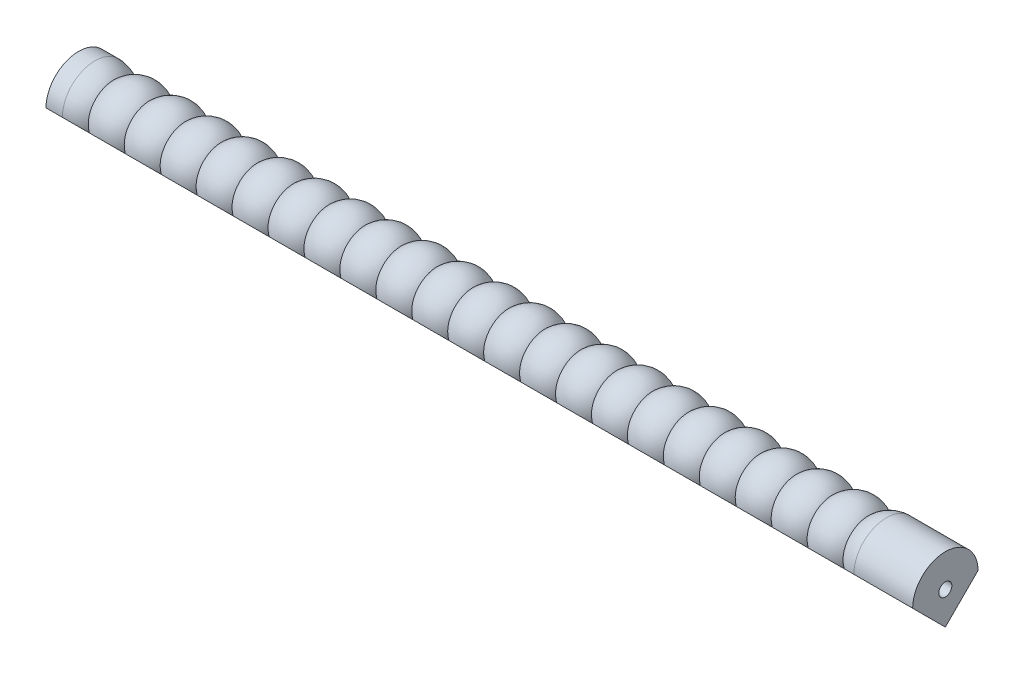
from build123d import *

# Parameters (mm, degrees)
CUT_EXTRUDE1_START = -150
CUT_EXTRUDE1_DEPTH = 150


with BuildPart() as part:
    # Sketch1 → Revolve2 (revolve)
    with BuildSketch(Plane(origin=(0, 0, 0), x_dir=(1, 0, 0), z_dir=(0, 1, 0)), mode=Mode.PRIVATE) as revolve2_sk:
        with BuildLine():
            Line((0, 0), (0, 5))
            Line((0, 5), (2.5, 5))
            ThreePointArc((2.5, 5), (4.038280284, 4.716911107), (5.375, 3.90473751))
            ThreePointArc((5.375, 3.90473751), (8.125, 5), (10.875, 3.90473751))
            ThreePointArc((10.875, 3.90473751), (13.625, 5), (16.375, 3.90473751))
            ThreePointArc((16.375, 3.90473751), (19.125, 5), (21.875, 3.90473751))
            ThreePointArc((21.875, 3.90473751), (24.625, 5), (27.375, 3.90473751))
            ThreePointArc((27.375, 3.90473751), (30.125, 5), (32.875, 3.90473751))
            ThreePointArc((32.875, 3.90473751), (35.625, 5), (38.375, 3.90473751))
            ThreePointArc((38.375, 3.90473751), (41.125, 5), (43.875, 3.90473751))
            ThreePointArc((43.875, 3.90473751), (46.625, 5), (49.375, 3.90473751))
            ThreePointArc((49.375, 3.90473751), (52.125, 5), (54.875, 3.90473751))
            ThreePointArc((54.875, 3.90473751), (57.625, 5), (60.375, 3.90473751))
            ThreePointArc((60.375, 3.90473751), (63.125, 5), (65.875, 3.90473751))
            ThreePointArc((65.875, 3.90473751), (68.625, 5), (71.375, 3.90473751))
            ThreePointArc((71.375, 3.90473751), (74.125, 5), (76.875, 3.90473751))
            ThreePointArc((76.875, 3.90473751), (79.625, 5), (82.375, 3.90473751))
            ThreePointArc((82.375, 3.90473751), (85.125, 5), (87.875, 3.90473751))
            ThreePointArc((87.875, 3.90473751), (90.625, 5), (93.375, 3.90473751))
            ThreePointArc((93.375, 3.90473751), (96.125, 5), (98.875, 3.90473751))
            ThreePointArc((98.875, 3.90473751), (101.625, 5), (104.375, 3.90473751))
            ThreePointArc((104.375, 3.90473751), (107.125, 5), (109.875, 3.90473751))
            ThreePointArc((109.875, 3.90473751), (112.625, 5), (115.375, 3.90473751))
            ThreePointArc((115.375, 3.90473751), (118.125, 5), (120.875, 3.90473751))
            ThreePointArc((120.875, 3.90473751), (122.144957777, 4.7161102), (123.625, 5))
            Line((123.625, 5), (132.625, 5))
            Line((132.625, 5), (132.625, 1))
            Line((132.625, 1), (125, 1))
            ThreePointArc((125, 1), (123.625, 2.375), (122.25, 1))
            Line((122.25, 1), (120.875, 1))
            Line((120.875, 1), (119.5, 1))
            ThreePointArc((119.5, 1), (118.125, 2.375), (116.75, 1))
            Line((116.75, 1), (115.375, 1))
            Line((115.375, 1), (114, 1))
            ThreePointArc((114, 1), (112.625, 2.375), (111.25, 1))
            Line((111.25, 1), (109.875, 1))
            Line((109.875, 1), (108.5, 1))
            ThreePointArc((108.5, 1), (107.125, 2.375), (105.75, 1))
            Line((105.75, 1), (104.375, 1))
            Line((104.375, 1), (103, 1))
            ThreePointArc((103, 1), (101.625, 2.375), (100.25, 1))
            Line((100.25, 1), (98.875, 1))
            Line((98.875, 1), (97.5, 1))
            ThreePointArc((97.5, 1), (96.125, 2.375), (94.75, 1))
            Line((94.75, 1), (93.375, 1))
            Line((93.375, 1), (92, 1))
            ThreePointArc((92, 1), (90.625, 2.375), (89.25, 1))
            Line((89.25, 1), (87.875, 1))
            Line((87.875, 1), (86.5, 1))
            ThreePointArc((86.5, 1), (85.125, 2.375), (83.75, 1))
            Line((83.75, 1), (82.375, 1))
            Line((82.375, 1), (81, 1))
            ThreePointArc((81, 1), (79.625, 2.375), (78.25, 1))
            Line((78.25, 1), (76.875, 1))
            Line((76.875, 1), (75.5, 1))
            ThreePointArc((75.5, 1), (74.125, 2.375), (72.75, 1))
            Line((72.75, 1), (71.375, 1))
            Line((71.375, 1), (70, 1))
            ThreePointArc((70, 1), (68.625, 2.375), (67.25, 1))
            Line((67.25, 1), (65.875, 1))
            Line((65.875, 1), (64.5, 1))
            ThreePointArc((64.5, 1), (63.125, 2.375), (61.75, 1))
            Line((61.75, 1), (60.375, 1))
            Line((60.375, 1), (59, 1))
            ThreePointArc((59, 1), (57.625, 2.375), (56.25, 1))
            Line((56.25, 1), (54.875, 1))
            Line((54.875, 1), (53.5, 1))
            ThreePointArc((53.5, 1), (52.125, 2.375), (50.75, 1))
            Line((50.75, 1), (49.375, 1))
            Line((49.375, 1), (48, 1))
            ThreePointArc((48, 1), (46.625, 2.375), (45.25, 1))
            Line((45.25, 1), (43.875, 1))
            Line((43.875, 1), (42.5, 1))
            ThreePointArc((42.5, 1), (41.125, 2.375), (39.75, 1))
            Line((39.75, 1), (38.375, 1))
            Line((38.375, 1), (37, 1))
            ThreePointArc((37, 1), (35.625, 2.375), (34.25, 1))
            Line((34.25, 1), (32.875, 1))
            Line((32.875, 1), (31.5, 1))
            ThreePointArc((31.5, 1), (30.125, 2.375), (28.75, 1))
            Line((28.75, 1), (27.375, 1))
            Line((27.375, 1), (26, 1))
            ThreePointArc((26, 1), (24.625, 2.375), (23.25, 1))
            Line((23.25, 1), (21.875, 1))
            Line((21.875, 1), (20.5, 1))
            ThreePointArc((20.5, 1), (19.125, 2.375), (17.75, 1))
            Line((17.75, 1), (16.375, 1))
            Line((16.375, 1), (15, 1))
            ThreePointArc((15, 1), (13.625, 2.375), (12.25, 1))
            Line((12.25, 1), (10.875, 1))
            Line((10.875, 1), (9.5, 1))
            ThreePointArc((9.5, 1), (8.125, 2.375), (6.75, 1))
            Line((6.75, 1), (5.375, 1))
            Line((5.375, 1), (4, 1))
            ThreePointArc((4, 1), (3.560660172, 2.060660172), (2.5, 2.5))
            Line((2.5, 2.5), (2.5, 0))
            Line((2.5, 0), (0, 0))
        make_face()
    revolve(revolve2_sk.sketch.rotate(Axis((0, 0, 0), (1, 0, 0)), 180), axis=Axis((0, 0, 0), (1, 0, 0)))

    # Sketch2 → Cut-Extrude1 (cut)
    with BuildSketch(Plane.ZY.offset(CUT_EXTRUDE1_START)):
        with BuildLine():
            ThreePointArc((0, -5), (3.535533906, -3.535533906), (5, 0))
            Line((5, 0), (0, -5))
        make_face()
        with BuildLine():
            Line((0, -5), (-5, 0))
            ThreePointArc((-5, 0), (-3.535533906, -3.535533906), (0, -5))
        make_face()
    extrude(amount=CUT_EXTRUDE1_DEPTH, mode=Mode.SUBTRACT)


solid = part.part
